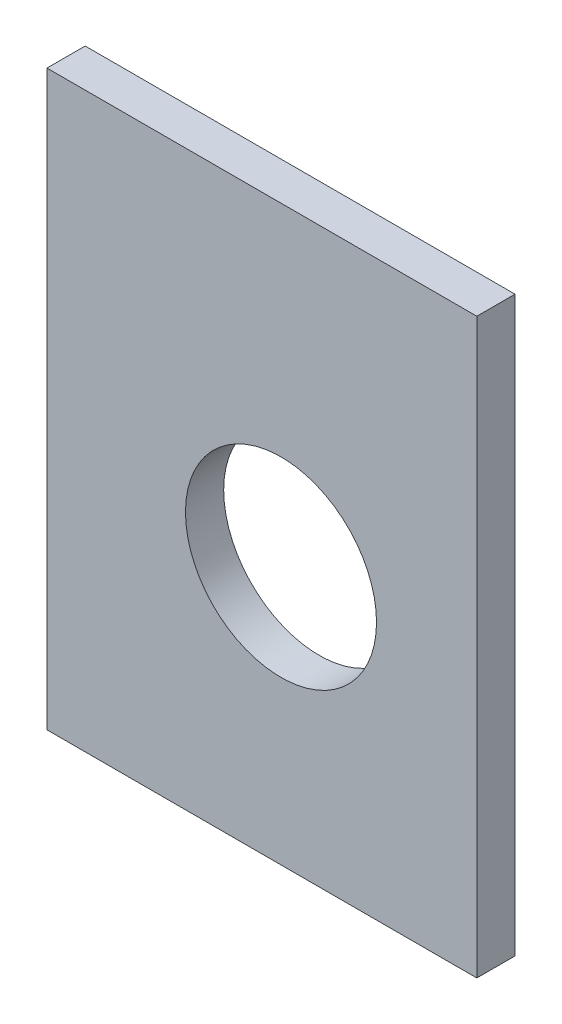
from build123d import *

# Parameters (mm, degrees)
SKETCH1_W           = 45
SKETCH1_H           = 60
SKETCH1_R           = 10
BOSS_EXTRUDE1_DEPTH = 4


with BuildPart() as part:
    # Sketch1 → Boss-Extrude1 (new body)
    with BuildSketch(Plane.XY):
        Rectangle(SKETCH1_W, SKETCH1_H)
        with Locations((2, -3)):
            Circle(SKETCH1_R, mode=Mode.SUBTRACT)
    extrude(amount=BOSS_EXTRUDE1_DEPTH)


solid = part.part
